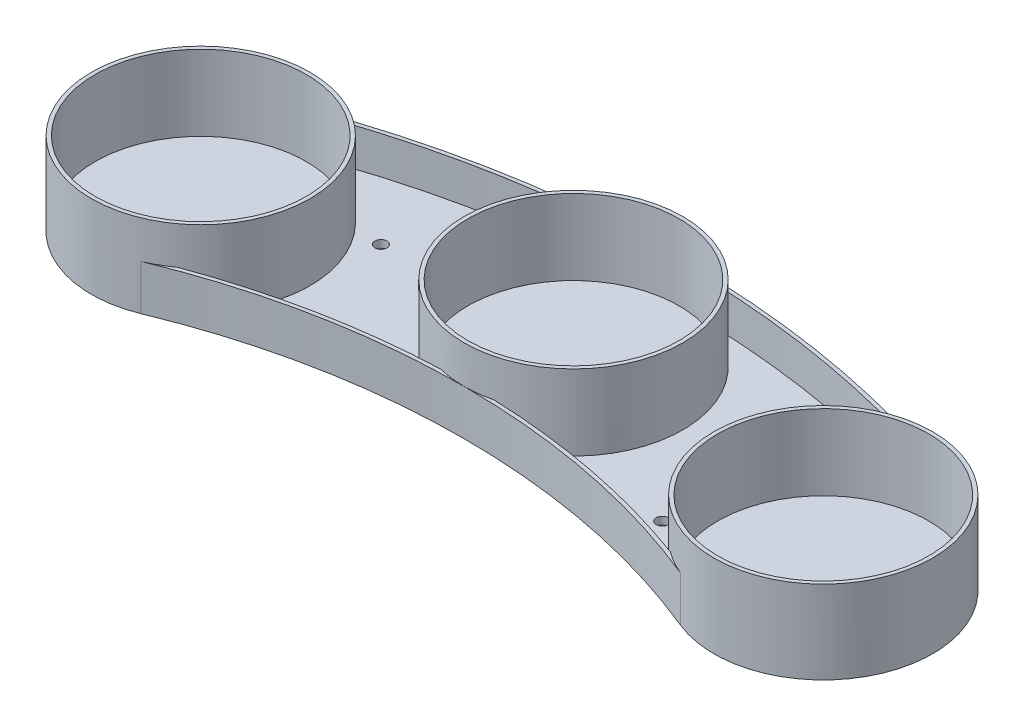
from build123d import *

# Parameters (mm, degrees)
EXTRUDE_1_DEPTH     = 2
SKETCH_2_R          = 29
SKETCH_2_R_2        = 28
EXTRUDE_2_DEPTH     = 20
SKETCH_3_R          = 1.6
CUT_EXTRUDE_1_DEPTH = 10
EXTRUDE_3_DEPTH     = 10


with BuildPart() as part:
    # 草图1 → 凸台-拉伸1 (new body)
    with BuildSketch(Plane(origin=(0, 0, 0), x_dir=(1, 0, 0), z_dir=(0, 1, 0))):
        with BuildLine():
            ThreePointArc((-93.525346, 227.528042), (0, 246), (93.525346, 227.528042))
            ThreePointArc((93.525346, 227.528042), (109.322411, 189.680285), (71.474654, 173.883219))
            ThreePointArc((71.474654, 173.883219), (0, 188), (-71.474654, 173.883219))
            ThreePointArc((-71.474654, 173.883219), (-109.322411, 189.680285), (-93.525346, 227.528042))
        make_face()
    extrude(amount=EXTRUDE_1_DEPTH)

    # 草图2 → 凸台-拉伸2 (add)
    # profile 1 of 3: a face of its own
    with BuildSketch(Plane(origin=(0, 2, 0), x_dir=(1, 0, 0), z_dir=(0, 1, 0))):
        with Locations(Location((-82.5, 200.70563, 0), (0, 0, 112.345101))):
            Circle(SKETCH_2_R)
        with Locations(Location((-82.5, 200.70563, 0), (0, 0, 270))):
            Circle(SKETCH_2_R_2, mode=Mode.SUBTRACT)
    # profile 2 of 3: a face of its own
    with BuildSketch(Plane(origin=(0, 2, 0), x_dir=(1, 0, 0), z_dir=(0, 1, 0))):
        with Locations(Location((0, 217, 0), (0, 0, 270))):
            Circle(SKETCH_2_R)
        with Locations(Location((0, 217, 0), (0, 0, 270))):
            Circle(SKETCH_2_R_2, mode=Mode.SUBTRACT)
    # profile 3 of 3: a face of its own
    with BuildSketch(Plane(origin=(0, 2, 0), x_dir=(1, 0, 0), z_dir=(0, 1, 0))):
        with Locations(Location((82.5, 200.70563, 0), (0, 0, 67.654899))):
            Circle(SKETCH_2_R)
        with Locations(Location((82.5, 200.70563, 0), (0, 0, 270))):
            Circle(SKETCH_2_R_2, mode=Mode.SUBTRACT)
    extrude(amount=EXTRUDE_2_DEPTH)

    # 草图3 → 切除-拉伸1 (cut)
    with BuildSketch(Plane(origin=(0, 2, 0), x_dir=(1, 0, 0), z_dir=(0, 1, 0))):
        with Locations(Location((-53.6033, 219.551102, 0), (0, 0, 270))):
            Circle(SKETCH_3_R)
        with Locations(Location((-47.199366, 193.321545, 0), (0, 0, 270))):
            Circle(SKETCH_3_R)
        with Locations(Location((53.6033, 219.551102, 0), (0, 0, 270))):
            Circle(SKETCH_3_R)
        with Locations(Location((47.199366, 193.321545, 0), (0, 0, 270))):
            Circle(SKETCH_3_R)
    extrude(amount=-CUT_EXTRUDE_1_DEPTH, mode=Mode.SUBTRACT)

    # 草图4 → 凸台-拉伸3 (add)
    with BuildSketch(Plane(origin=(0, 2, 0), x_dir=(1, 0, 0), z_dir=(0, 1, 0))):
        with BuildLine():
            Line((93.145161, 226.603131), (93.525346, 227.528042))
            ThreePointArc((93.525346, 227.528042), (0, 246), (-93.525346, 227.528042))
            Line((-93.525346, 227.528042), (-93.145161, 226.603131))
            ThreePointArc((-93.145161, 226.603131), (0, 245), (93.145161, 226.603131))
        make_face()
        with BuildLine():
            Line((71.474654, 173.883219), (71.854839, 174.80813))
            ThreePointArc((71.854839, 174.80813), (0, 189), (-71.854839, 174.80813))
            Line((-71.854839, 174.80813), (-71.474654, 173.883219))
            ThreePointArc((-71.474654, 173.883219), (0, 188), (71.474654, 173.883219))
        make_face()
    extrude(amount=EXTRUDE_3_DEPTH)


solid = part.part
